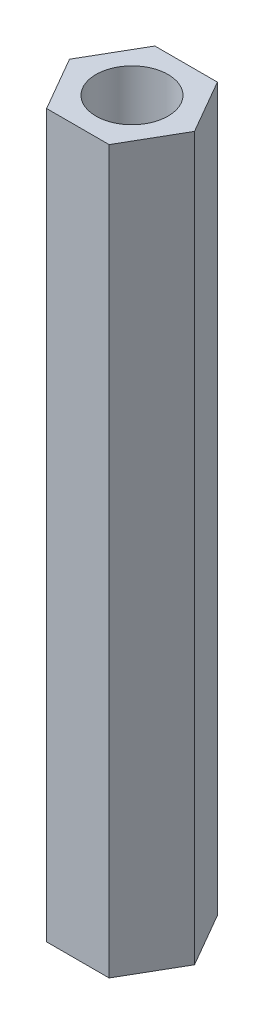
from build123d import *

# Parameters (mm, degrees)
SKETCH_1_R      = 2
EXTRUDE_2_DEPTH = 40


with BuildPart() as part:
    # 草图1 → 凸台-拉伸2 (new body)
    with BuildSketch(Plane(origin=(0, 0, 0), x_dir=(1, 0, 0), z_dir=(0, 1, 0))):
        Polygon((-1.73, 3), (1.73, 3), (1.732050808, 3), (1.733076211, 2.998223949), (3.463076211, 0.001776051), (3.464101615, 0), (3.463076211, -0.001776051), (1.733076211, -2.998223949), (1.732050808, -3), (1.73, -3), (-1.73, -3), (-1.732050808, -3), (-1.733076211, -2.998223949), (-3.463076211, -0.001776051), (-3.464101615, 0), (-3.463076211, 0.001776051), (-1.733076211, 2.998223949), (-1.732050808, 3), align=None)
        with Locations(Location((0, 0, 0), (0, 0, 270))):
            Circle(SKETCH_1_R, mode=Mode.SUBTRACT)
    extrude(amount=EXTRUDE_2_DEPTH)


solid = part.part
